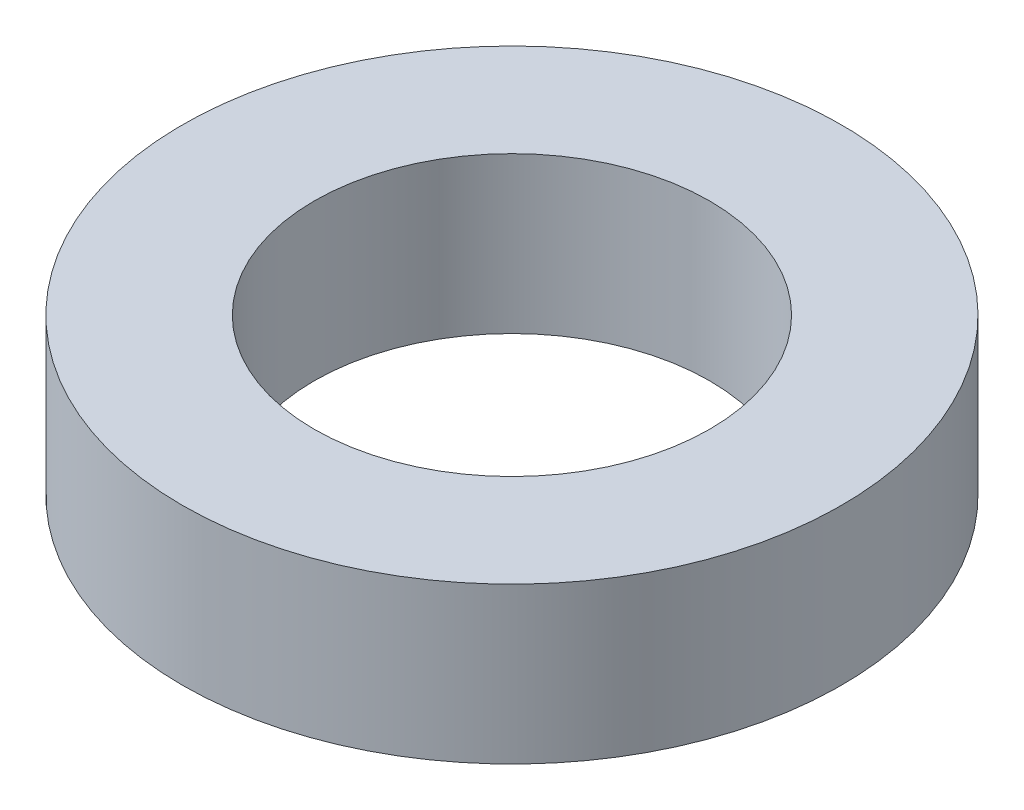
from build123d import *

# Parameters (mm, degrees)
SKETCH1_R           = 2.75
BOSS_EXTRUDE1_DEPTH = 1.3
SKETCH2_R           = 1.65
CUT_EXTRUDE1_DEPTH  = 1.3


with BuildPart() as part:
    # Sketch1 → Boss-Extrude1 (new body)
    with BuildSketch(Plane(origin=(0, 0, 0), x_dir=(1, 0, 0), z_dir=(0, 1, 0))):
        with Locations(Location((0, 0, 0), (0, 0, 270))):
            Circle(SKETCH1_R)
    extrude(amount=BOSS_EXTRUDE1_DEPTH)

    # Sketch2 → Cut-Extrude1 (cut)
    with BuildSketch(Plane.XZ):
        with Locations(Location((0, 0, 0), (0, 0, 270))):
            Circle(SKETCH2_R)
    extrude(amount=-CUT_EXTRUDE1_DEPTH, mode=Mode.SUBTRACT)


solid = part.part
